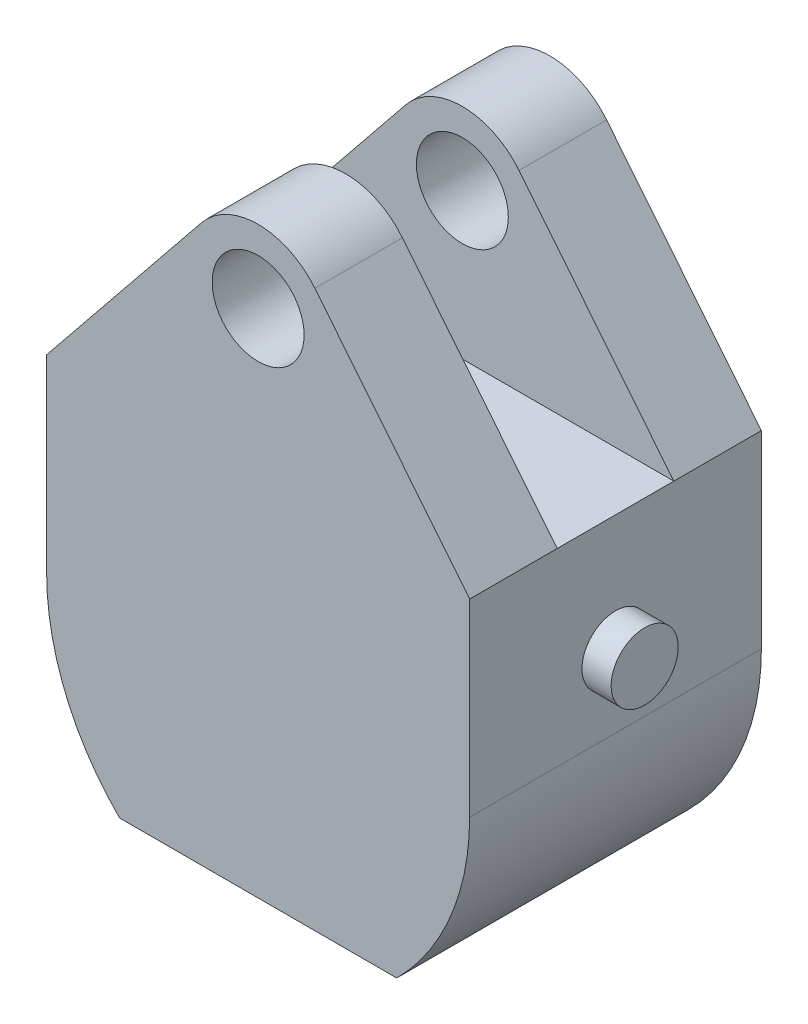
from build123d import *

# Parameters (mm, degrees)
SKETCH1_W                = 29
SKETCH1_H                = 40
BOSS_EXTRUDE1_DEPTH      = 20
SKETCH2_W                = 29
SKETCH2_H                = 8
CUT_EXTRUDE1_DEPTH       = 15
SKETCH3_R                = 3.15
CUT_EXTRUDE2_DEPTH       = 30
FILLET1_R                = 17
BOSS_EXTRUDE2_DEPTH      = 2
BOSS_EXTRUDE2_DEPTH_BACK = 32
SKETCH4_R                = 2.3


with BuildPart() as part:
    # Sketch1 → Boss-Extrude1 (new body)
    with BuildSketch(Plane.XY):
        with Locations((14.5, -20)):
            Rectangle(SKETCH1_W, SKETCH1_H)
    extrude(amount=BOSS_EXTRUDE1_DEPTH)

    # Sketch2 → Cut-Extrude1 (cut)
    with BuildSketch(Plane(origin=(0, 0, 0), x_dir=(1, 0, 0), z_dir=(0, 1, 0))):
        with Locations((14.5, -10)):
            Rectangle(SKETCH2_W, SKETCH2_H)
    extrude(amount=-CUT_EXTRUDE1_DEPTH, mode=Mode.SUBTRACT)

    # Sketch3 → Cut-Extrude2 (cut)
    with BuildSketch(Plane.XY.offset(20)):
        with BuildLine():
            Line((0, 0), (0, -15))
            Line((0, -15), (10.60969448, -1.859056995))
            ThreePointArc((10.60969448, -1.859056995), (12.344160839, -0.488641279), (14.5, 0))
            Line((14.5, 0), (0, 0))
        make_face()
        with BuildLine():
            Line((29, 0), (14.5, 0))
            ThreePointArc((14.5, 0), (16.655839161, -0.488641279), (18.39030552, -1.859056995))
            Line((18.39030552, -1.859056995), (29, -15))
            Line((29, -15), (29, 0))
        make_face()
        Polygon((5, -40), (0, -35), (0, -40), align=None)
        Polygon((29, -35), (24, -40), (29, -40), align=None)
        with Locations((14.5, -5)):
            Circle(SKETCH3_R)
    extrude(amount=-CUT_EXTRUDE2_DEPTH, mode=Mode.SUBTRACT)

    # Fillet1
    fillet1_edges = [part.edges().sort_by_distance(p)[0] for p in [
        (29, -35, 10),
        (0, -35, 10),
    ]]
    fillet(fillet1_edges, radius=FILLET1_R)

    # Sketch4 → Boss-Extrude2 (add, two sides: drawn at the far end of the back side and taken through both)
    with BuildSketch(Plane(origin=(29, 0, 0), x_dir=(0, 0, -1), z_dir=(1, 0, 0)).offset(-BOSS_EXTRUDE2_DEPTH_BACK)):
        with Locations(Location((-10, -23, 0), (0, 0, 90))):
            Circle(SKETCH4_R)
    extrude(amount=BOSS_EXTRUDE2_DEPTH + BOSS_EXTRUDE2_DEPTH_BACK)


solid = part.part
